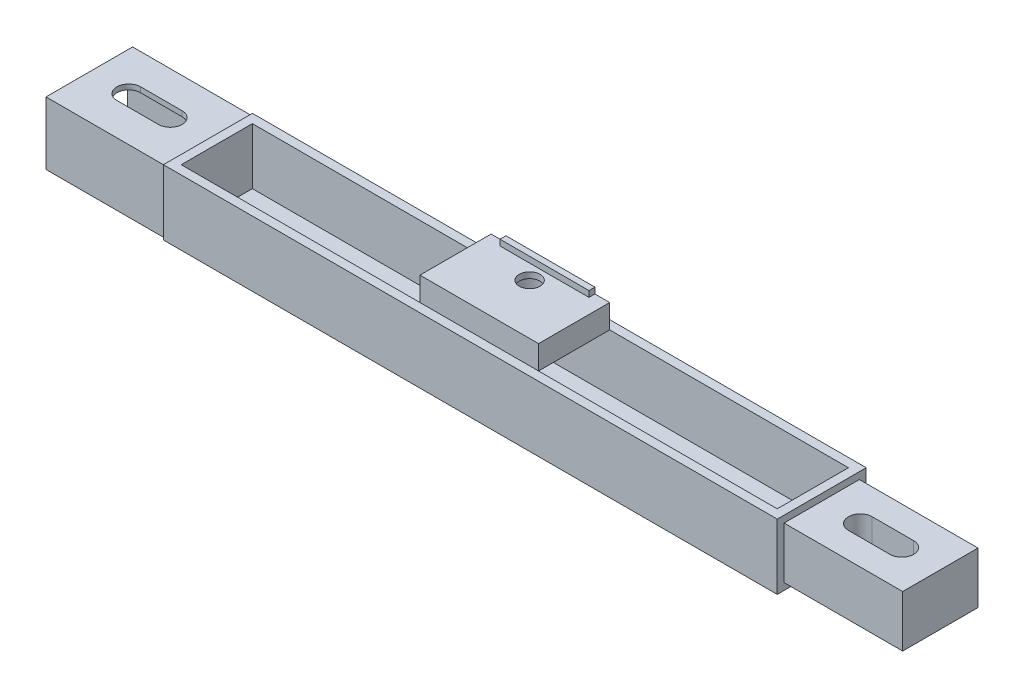
from build123d import *

# Parameters (mm, degrees)
SKETCH1_W           = 207
SKETCH1_H           = 30
BOSS_EXTRUDE1_DEPTH = 22
SHELL1_T            = -3
SKETCH2_W           = 207
SKETCH2_H           = 10
CUT_EXTRUDE1_DEPTH  = 3
SKETCH3_W           = 29.2
SKETCH3_H           = 21.2
BOSS_EXTRUDE2_DEPTH = 40
SKETCH4_W           = 25.7
SKETCH4_H           = 17.7
CUT_EXTRUDE2_DEPTH  = 40
CUT_EXTRUDE3_DEPTH  = 146.889718623
SKETCH6_W           = 25.4
SKETCH6_H           = 17.4
BOSS_EXTRUDE3_DEPTH = 40
CUT_EXTRUDE4_DEPTH  = 146.620534266
SKETCH8_W           = 40
SKETCH8_H           = 24
BOSS_EXTRUDE4_DEPTH = 8
SKETCH9_R           = 3.5
CUT_EXTRUDE6_DEPTH  = 8
SKETCH10_R          = 6.5
CUT_EXTRUDE10_DEPTH = 6
SKETCH11_W          = 30
SKETCH11_H          = 2
BOSS_EXTRUDE5_DEPTH = 2


with BuildPart() as part:
    # Sketch1 → Boss-Extrude1 (new body)
    with BuildSketch(Plane(origin=(0, 0, 0), x_dir=(1, 0, 0), z_dir=(0, 1, 0))):
        Rectangle(SKETCH1_W, SKETCH1_H)
    extrude(amount=BOSS_EXTRUDE1_DEPTH)

    # Shell1
    shell1_openings = [part.faces().sort_by_distance(p)[0] for p in [
        (0, 22, 0),
    ]]
    offset(amount=SHELL1_T, openings=shell1_openings, kind=Kind.INTERSECTION)

    # Sketch2 → Cut-Extrude1 (cut)
    with BuildSketch(Plane(origin=(0, 0, 0), x_dir=(-1, 0, 0), z_dir=(0, -1, 0))):
        Rectangle(SKETCH2_W, SKETCH2_H)
    extrude(amount=-CUT_EXTRUDE1_DEPTH, mode=Mode.SUBTRACT)

    # Sketch3 → Boss-Extrude2 (add)
    with BuildSketch(Plane.ZY.offset(103.5)):
        with Locations((0, 11)):
            Rectangle(SKETCH3_W, SKETCH3_H)
    extrude(amount=BOSS_EXTRUDE2_DEPTH)

    # Sketch4 → Cut-Extrude2 (cut)
    with BuildSketch(Plane.ZY.offset(143.5)):
        with Locations((0, 11)):
            Rectangle(SKETCH4_W, SKETCH4_H)
    extrude(amount=-CUT_EXTRUDE2_DEPTH, mode=Mode.SUBTRACT)

    # Sketch5 → Cut-Extrude3 (cut, through all)
    with BuildSketch(Plane(origin=(0, 21.6, 0), x_dir=(1, 0, 0), z_dir=(0, 1, 0))):
        with BuildLine():
            Line((-130.5, 4.306739795), (-116.5, 4.306739795))
            ThreePointArc((-116.5, 4.306739795), (-112.5, 0.306739795), (-116.5, -3.693260205))
            Line((-116.5, -3.693260205), (-130.5, -3.693260205))
            ThreePointArc((-130.5, -3.693260205), (-134.5, 0.306739795), (-130.5, 4.306739795))
        make_face()
    extrude(amount=-CUT_EXTRUDE3_DEPTH, mode=Mode.SUBTRACT)

    # Sketch6 → Boss-Extrude3 (add)
    with BuildSketch(Plane(origin=(103.5, 0, 0), x_dir=(0, 0, -1), z_dir=(1, 0, 0))):
        with Locations((0, 11)):
            Rectangle(SKETCH6_W, SKETCH6_H)
    extrude(amount=BOSS_EXTRUDE3_DEPTH)

    # Sketch7 → Cut-Extrude4 (cut, through all)
    with BuildSketch(Plane(origin=(0, 19.7, 0), x_dir=(1, 0, 0), z_dir=(0, 1, 0))):
        with BuildLine():
            Line((116.5, 4), (130.5, 4))
            ThreePointArc((130.5, 4), (134.5, 0), (130.5, -4))
            Line((130.5, -4), (116.5, -4))
            ThreePointArc((116.5, -4), (112.5, 0), (116.5, 4))
        make_face()
    extrude(amount=-CUT_EXTRUDE4_DEPTH, mode=Mode.SUBTRACT)


with BuildPart() as body_2:
    # Sketch8 → Boss-Extrude4 (new body)
    with BuildSketch(Plane(origin=(0, 22, 0), x_dir=(1, 0, 0), z_dir=(0, 1, 0))):
        Rectangle(SKETCH8_W, SKETCH8_H)
    extrude(amount=BOSS_EXTRUDE4_DEPTH)

    # Sketch9 → Cut-Extrude6 (cut)
    with BuildSketch(Plane(origin=(0, 30, 0), x_dir=(1, 0, 0), z_dir=(0, 1, 0))):
        with Locations(Location((0, 5, 0), (0, 0, 270))):
            Circle(SKETCH9_R)
    extrude(amount=-CUT_EXTRUDE6_DEPTH, mode=Mode.SUBTRACT)

    # Sketch10 → Cut-Extrude10 (cut)
    with BuildSketch(Plane.XZ.offset(-22)):
        with Locations(Location((0, -5, 0), (0, 0, 270))):
            Circle(SKETCH10_R)
    extrude(amount=-CUT_EXTRUDE10_DEPTH, mode=Mode.SUBTRACT)

    # Sketch11 → Boss-Extrude5 (add)
    with BuildSketch(Plane(origin=(0, 30, 0), x_dir=(1, 0, 0), z_dir=(0, 1, 0))):
        with Locations((0, 11)):
            Rectangle(SKETCH11_W, SKETCH11_H)
    extrude(amount=BOSS_EXTRUDE5_DEPTH)


solid = Compound([part.part, body_2.part])
